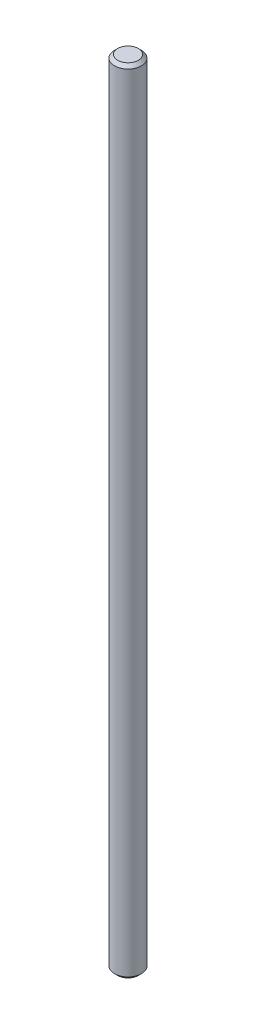
from build123d import *

# Parameters (mm, degrees)
SKETCH1_R      = 4.25
EXTRUDE1_DEPTH = 250
CHAMFER1_SIZE  = 1
CHAMFER2_SIZE  = 1


with BuildPart() as part:
    # Sketch1 → Extrude1 (new body)
    with BuildSketch(Plane(origin=(0, 0, 0), x_dir=(1, 0, 0), z_dir=(0, 1, 0))):
        with Locations(Location((0, 0, 0), (0, 0, 270))):
            Circle(SKETCH1_R)
    extrude(amount=EXTRUDE1_DEPTH)

    # Chamfer1
    chamfer1_edges = [part.edges().sort_by_distance(p)[0] for p in [
        (0, 250, -4.25),
    ]]
    chamfer(chamfer1_edges, length=CHAMFER1_SIZE)

    # Chamfer2
    chamfer2_edges = [part.edges().sort_by_distance(p)[0] for p in [
        (0, 0, -4.25),
    ]]
    chamfer(chamfer2_edges, length=CHAMFER2_SIZE)


solid = part.part
